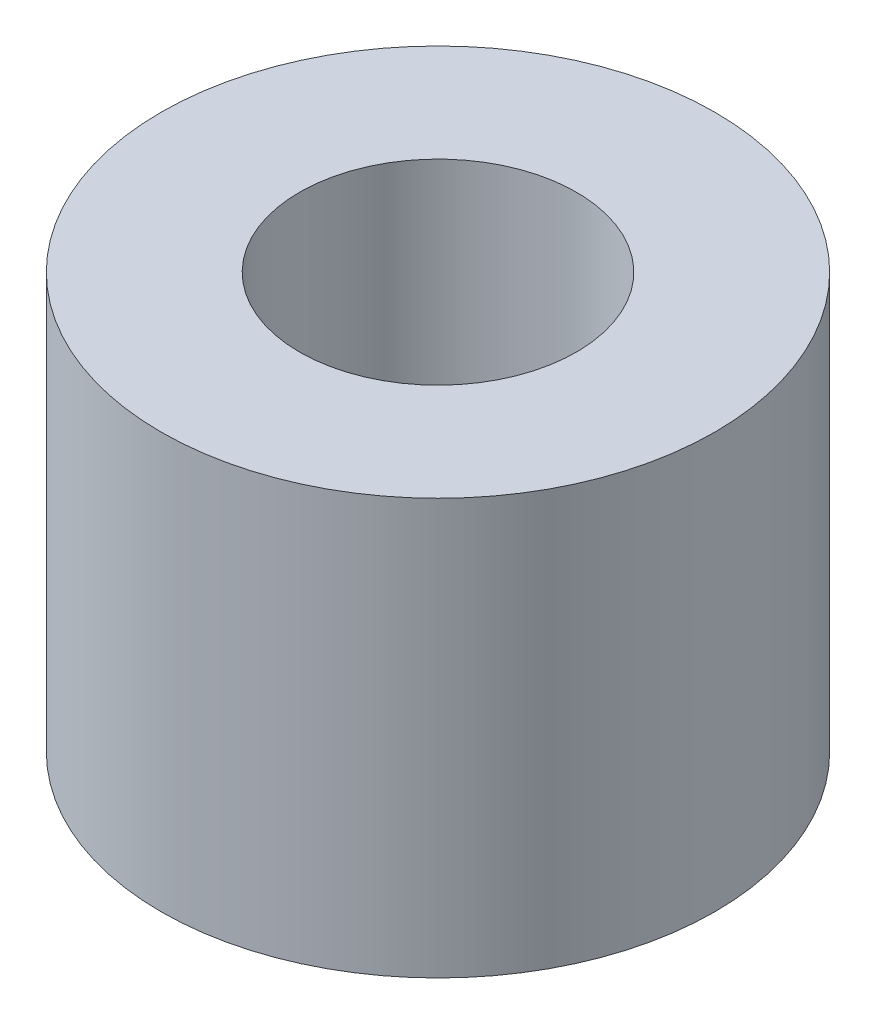
from build123d import *

# Parameters (mm, degrees)
SKETCH1_R           = 4
SKETCH1_R_2         = 2
BOSS_EXTRUDE1_DEPTH = 5
BOSS_EXTRUDE2_START = 1
SKETCH3_R           = 4
BOSS_EXTRUDE2_DEPTH = 1


with BuildPart() as part:
    # Sketch1 → Boss-Extrude1 (new body)
    with BuildSketch(Plane(origin=(0, 0, 0), x_dir=(1, 0, 0), z_dir=(0, 1, 0))):
        with Locations(Location((0, 0, 0), (0, 0, 270))):
            Circle(SKETCH1_R)
        with Locations(Location((0, 0, 0), (0, 0, 270))):
            Circle(SKETCH1_R_2, mode=Mode.SUBTRACT)
    extrude(amount=BOSS_EXTRUDE1_DEPTH)

    # Sketch3 → Boss-Extrude2 (add)
    with BuildSketch(Plane.XZ.offset(BOSS_EXTRUDE2_START)):
        with Locations(Location((0, 0, 0), (0, 0, 270))):
            Circle(SKETCH3_R)
    extrude(amount=-BOSS_EXTRUDE2_DEPTH)


solid = part.part
